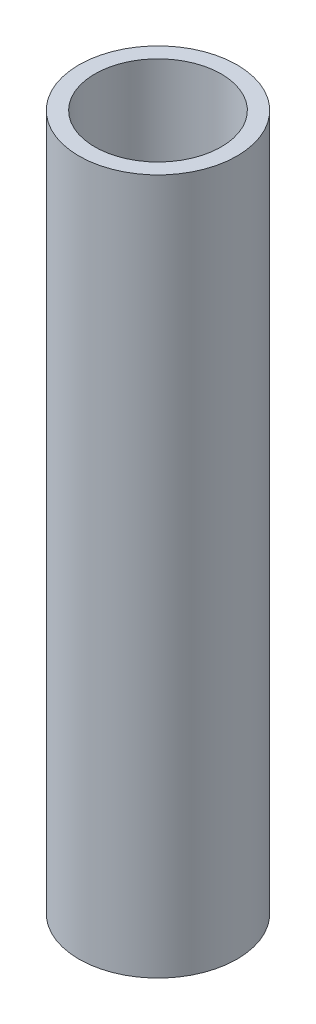
from build123d import *

# Parameters (mm, degrees)
SKETCH1_W = 1.5
SKETCH1_H = 66


with BuildPart() as part:
    # Sketch1 → Revolve1 (revolve)
    with BuildSketch(Plane.XY, mode=Mode.PRIVATE) as revolve1_sk:
        with Locations((6.75, 33)):
            Rectangle(SKETCH1_W, SKETCH1_H)
    revolve(revolve1_sk.sketch.rotate(Axis((0, 0, 0), (0, 1, 0)), 90), axis=Axis((0, 0, 0), (0, 1, 0)))


solid = part.part
